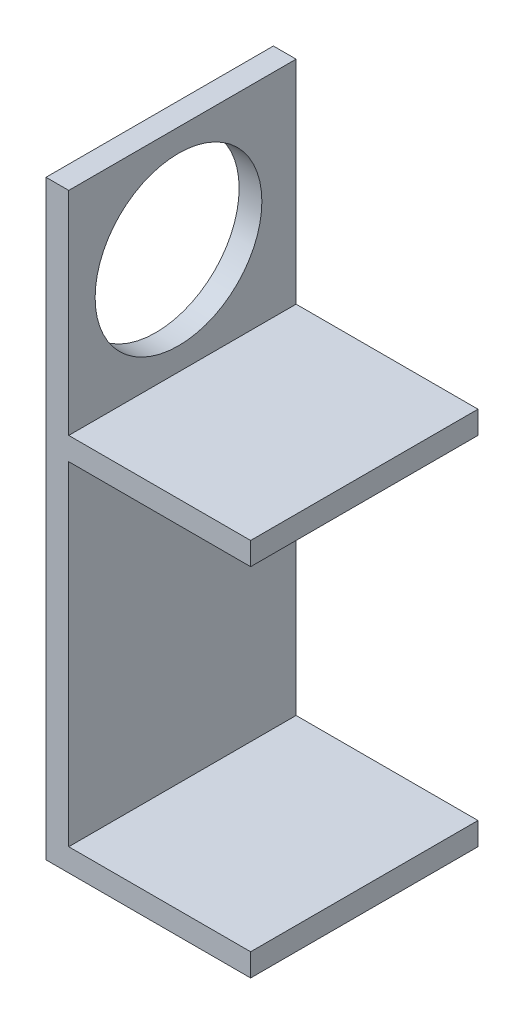
from build123d import *

# Parameters (mm, degrees)
EXTRUDE_1_DEPTH     = 30
SKETCH_2_W          = 3
SKETCH_2_H          = 30
EXTRUDE_2_DEPTH     = 28
CUT_EXTRUDE_1_REACH = 89.824
SKETCH_3_R          = 11


with BuildPart() as part:
    # 草图1 → 凸台-拉伸1 (new body)
    with BuildSketch(Plane.XY):
        Polygon((27, 47), (27, 50), (0, 50), (0, 0), (27, 0), (27, 3), (3, 3), (3, 47), align=None)
    extrude(amount=EXTRUDE_1_DEPTH)

    # 草图2 → 凸台-拉伸2 (add)
    with BuildSketch(Plane(origin=(0, 50, 0), x_dir=(1, 0, 0), z_dir=(0, 1, 0))):
        with Locations((1.5, -15)):
            Rectangle(SKETCH_2_W, SKETCH_2_H)
    extrude(amount=EXTRUDE_2_DEPTH)

    # 草图3 → 切除-拉伸1 (cut, up to next)
    with BuildSketch(Plane.ZY, mode=Mode.PRIVATE) as cut_extrude_1_sk1:
        with Locations((15.518002159, 64)):
            Circle(SKETCH_3_R)
    cut_extrude_1_tool1 = extrude(cut_extrude_1_sk1.sketch, amount=-CUT_EXTRUDE_1_REACH, mode=Mode.PRIVATE) & part.part
    add(cut_extrude_1_tool1.solids().sort_by_distance((0, 64, 15.518002))[0], mode=Mode.SUBTRACT)


solid = part.part
